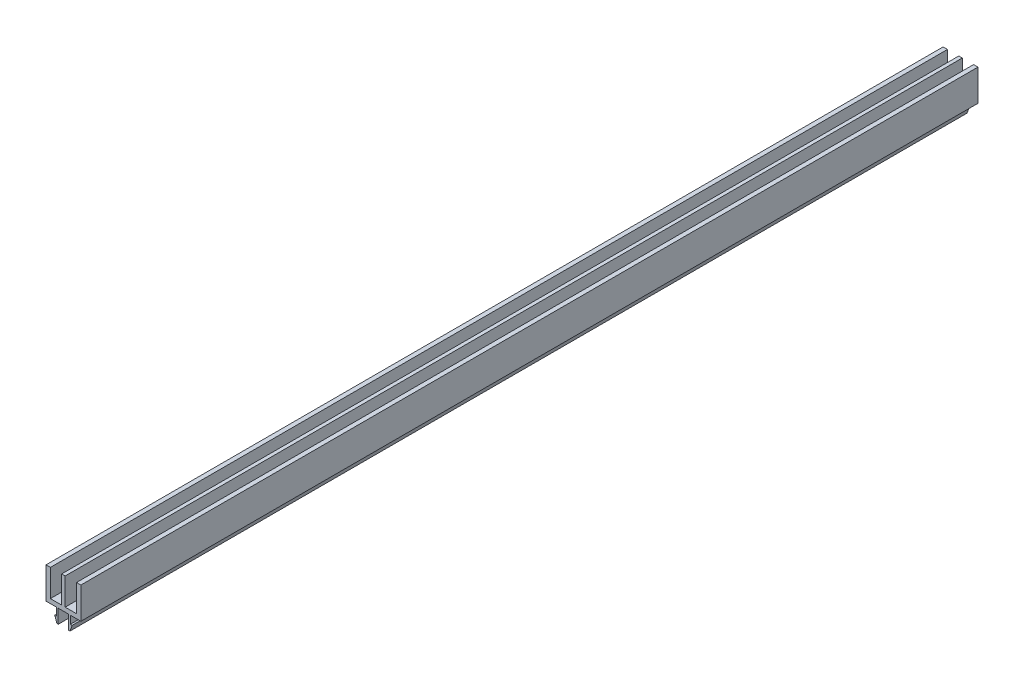
from build123d import *

# Parameters (mm, degrees)
BOSS_EXTRU_1_DEPTH = 514


with BuildPart() as part:
    # Esquisse1 → Boss.-Extru.1 (new body)
    with BuildSketch(Plane.XY.offset(50)):
        Polygon((-1, 2.5), (-7.5, 2.5), (-7.5, 17.999999998), (-10, 17.999999998), (-10, 0), (-4, 0), (-4, -4.5), (-5, -4.5), (-3.75, -8), (-3, -8), (-3, 0), (3, 0), (3, -8), (3.75, -8), (5, -4.5), (4, -4.5), (4, 0), (10, 0), (10, 17.999999998), (7.5, 17.999999998), (7.5, 2.5), (1, 2.5), (1, 17.999999998), (-1, 17.999999998), align=None)
    extrude(amount=-BOSS_EXTRU_1_DEPTH)


solid = part.part
